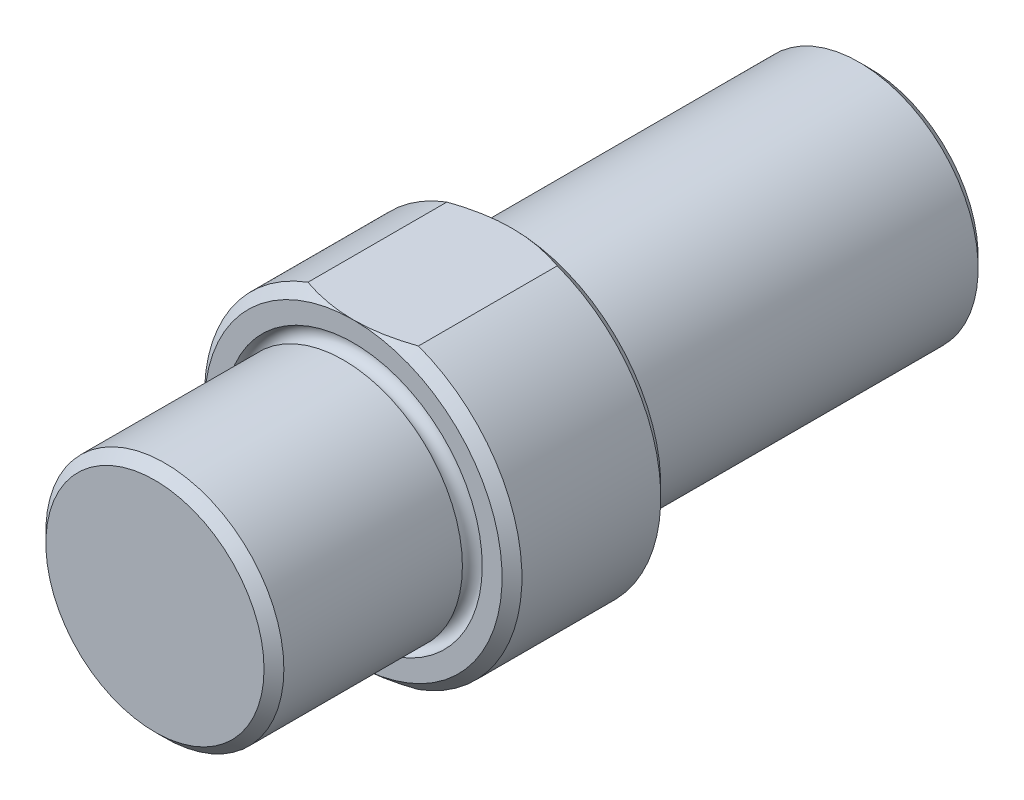
from build123d import *

# Parameters (mm, degrees)
M4X0_7_TAPPED_HOLE1_D     = 3.3
M4X0_7_TAPPED_HOLE1_DEPTH = 10
M4X0_7_TAPPED_HOLE1_TIP   = 0.991420021
SKETCH5_R                 = 0.25
CHAMFER1_SIZE             = 0.25
CUT_EXTRUDE1_REACH        = 12.63


with BuildPart() as part:
    # Sketch1 → Revolve1 (revolve)
    with BuildSketch(Plane(origin=(0, 0, 0), x_dir=(0, 0, -1), z_dir=(1, 0, 0)), mode=Mode.PRIVATE) as revolve1_sk:
        Polygon((-4, 4), (0, 4), (0, 3), (9, 3), (9, 0), (-9, 0), (-9, 3), (-4, 3), align=None)
    revolve(revolve1_sk.sketch.rotate(Axis((0, 0, -9), (0, 0, 1)), 90), axis=Axis((0, 0, -9), (0, 0, 1)))

    # M4x0.7 Tapped Hole1
    with Locations(Plane(origin=(0, 0, -9), x_dir=(-1, 0, 0), z_dir=(0, 0, -1))):
        with Locations((0, 0)):
            Hole(M4X0_7_TAPPED_HOLE1_D / 2, depth=M4X0_7_TAPPED_HOLE1_DEPTH)
            with Locations((0, 0, -(M4X0_7_TAPPED_HOLE1_DEPTH + M4X0_7_TAPPED_HOLE1_TIP / 2))):  # 118° drill point
                Cone(0, M4X0_7_TAPPED_HOLE1_D / 2, M4X0_7_TAPPED_HOLE1_TIP, mode=Mode.SUBTRACT)

    # Sketch5 → Cut-Revolve1 (revolve, cut)
    with BuildSketch(Plane(origin=(0, 0, 0), x_dir=(0, 0, -1), z_dir=(1, 0, 0)), mode=Mode.PRIVATE) as cut_revolve1_sk:
        with Locations((-4, 3)):
            Circle(SKETCH5_R)
        with Locations((0, 3)):
            Circle(SKETCH5_R)
    revolve(cut_revolve1_sk.sketch.rotate(Axis((0, 0, 9), (0, 0, -1)), 270), axis=Axis((0, 0, 9), (0, 0, -1)), mode=Mode.SUBTRACT)

    # Chamfer1
    chamfer1_edges = [part.edges().sort_by_distance(p)[0] for p in [
        (3, 0, 9),
        (3, 0, -9),
        (4, 0, 0),
        (4, 0, 4),
    ]]
    chamfer(chamfer1_edges, length=CHAMFER1_SIZE)

    # Sketch6 → Cut-Extrude1 (cut, up to next)
    with BuildSketch(Plane(origin=(0, 0, 0), x_dir=(-1, 0, 0), z_dir=(0, 0, -1)), mode=Mode.PRIVATE) as cut_extrude1_sk1:
        with BuildLine():
            ThreePointArc((1.391941091, 3.75), (0, 4), (-1.391941091, 3.75))
            Line((-1.391941091, 3.75), (1.391941091, 3.75))
        make_face()
    cut_extrude1_tool1 = extrude(cut_extrude1_sk1.sketch, amount=-CUT_EXTRUDE1_REACH, mode=Mode.PRIVATE) & part.part
    # Sketch6 → Cut-Extrude1 (cut, up to next)
    with BuildSketch(Plane(origin=(0, 0, 0), x_dir=(-1, 0, 0), z_dir=(0, 0, -1)), mode=Mode.PRIVATE) as cut_extrude1_sk2:
        with BuildLine():
            Line((1.391941091, -3.75), (-1.391941091, -3.75))
            ThreePointArc((-1.391941091, -3.75), (0, -4), (1.391941091, -3.75))
        make_face()
    cut_extrude1_tool2 = extrude(cut_extrude1_sk2.sketch, amount=-CUT_EXTRUDE1_REACH, mode=Mode.PRIVATE) & part.part
    add(cut_extrude1_tool1.solids().sort_by_distance((0, 3.850273, 0))[0], mode=Mode.SUBTRACT)
    add(cut_extrude1_tool2.solids().sort_by_distance((0, -3.850273, 0))[0], mode=Mode.SUBTRACT)


solid = part.part
